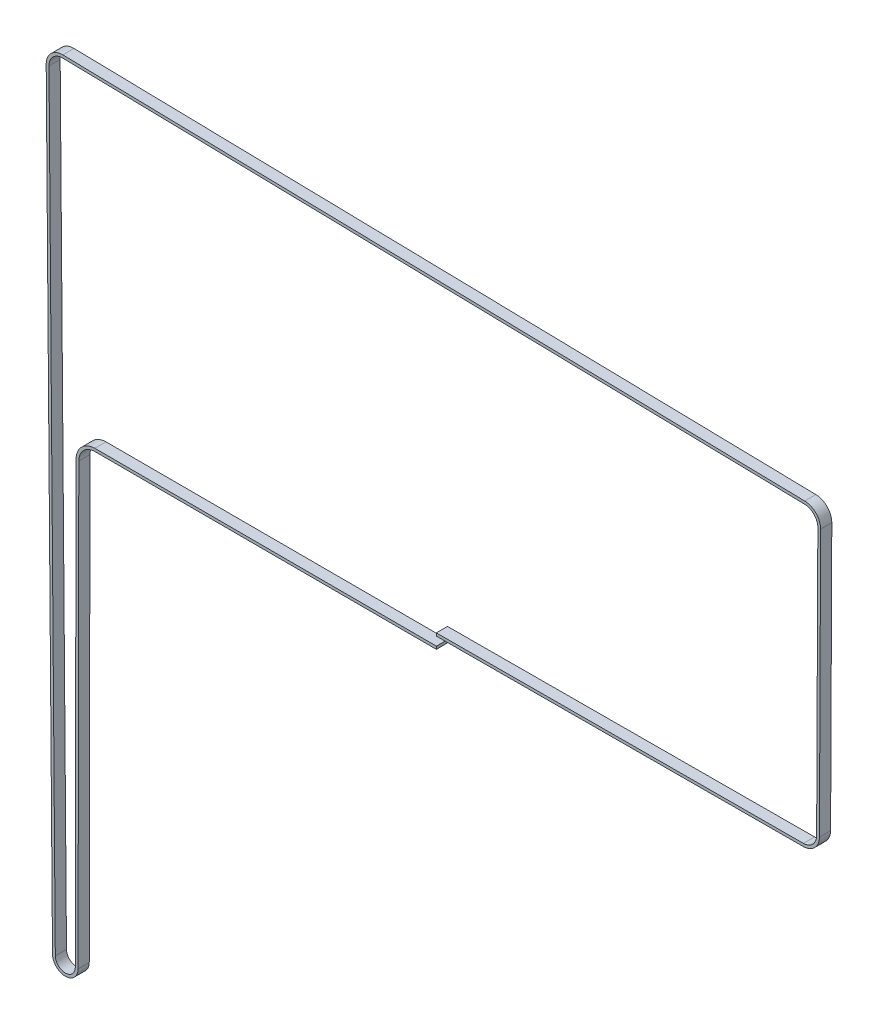
from build123d import *

# Parameters (mm, degrees)
EXTRUDE_1_DEPTH = 6


with BuildPart() as part:
    # Эскиз1 → Вытянуть-Тонкостенный1 (new body)
    with BuildSketch(Plane.XY):
        with BuildLine():
            Line((199.171010966, 244.669379092), (15.850409713, 244.973028732))
            ThreePointArc((15.850409713, 244.973028732), (9.76523397, 242.3635414), (7.250012003, 236.238800882))
            Line((7.250012003, 236.238800882), (6.858690591, -0.011360638))
            ThreePointArc((6.858690591, -0.011360638), (0.022547579, -6.858662938), (-6.858467649, -0.056455245))
            Line((-6.858467649, -0.056455245), (-10.249703578, 411.927977114))
            ThreePointArc((-10.249703578, 411.927977114), (-7.648126176, 418.225997476), (-1.317862082, 420.748104128))
            Line((-1.317862082, 420.748104128), (396.829346884, 412.458570479))
            ThreePointArc((396.829346884, 412.458570479), (402.912249078, 409.818802658), (405.397119956, 403.670998988))
            Line((405.397119956, 403.670998988), (404.749910989, 260.184840159))
            ThreePointArc((404.749910989, 260.184840159), (402.225998422, 254.076182312), (396.149590287, 251.475586319))
            Line((396.149590287, 251.475586319), (199.120398676, 250.818015146))
            Line((199.120398676, 250.818015146), (199.115392559, 252.318006792))
            Line((199.115392559, 252.318006792), (396.13377965, 252.975541906))
            ThreePointArc((396.13377965, 252.975541906), (401.162138455, 255.133646805), (403.249926248, 260.191605993))
            Line((403.249926248, 260.191605993), (403.897135215, 403.677764822))
            ThreePointArc((403.897135215, 403.677764822), (401.838242202, 408.771659292), (396.798123241, 410.958895487))
            Line((396.798123241, 410.958895487), (-1.349085725, 419.248429135))
            ThreePointArc((-1.349085725, 419.248429135), (-6.594161688, 417.158683623), (-8.749754393, 411.940323895))
            Line((-8.749754393, 411.940323895), (-5.358518464, -0.044108464))
            ThreePointArc((-5.358518464, -0.044108464), (0.017616416, -5.358671043), (5.358692649, -0.008876062))
            Line((5.358692649, -0.008876062), (5.750014061, 236.241285457))
            ThreePointArc((5.750014061, 236.241285457), (8.70154817, 243.421188856), (15.839385081, 246.473049051))
            Line((15.839385081, 246.473049051), (199.173495541, 246.169377034))
            Line((199.173495541, 246.169377034), (199.171010966, 244.669379092))
        make_face()
    extrude(amount=EXTRUDE_1_DEPTH)


solid = part.part
